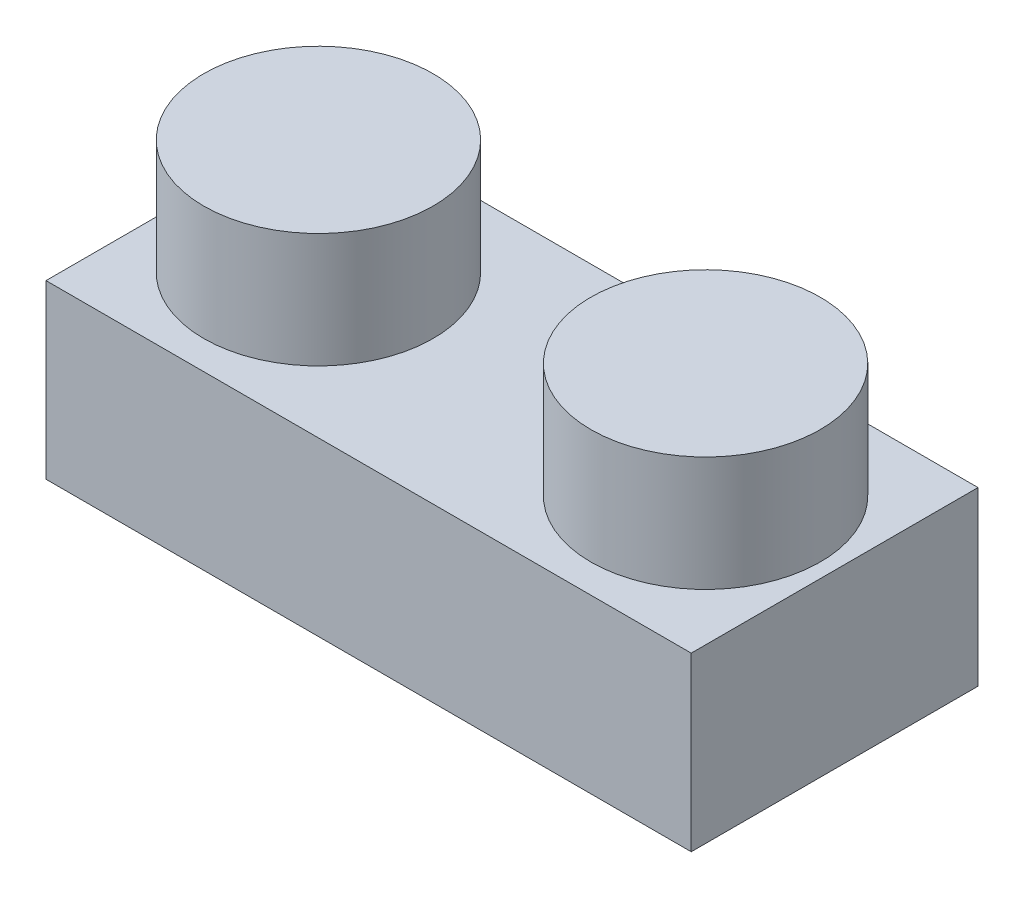
from build123d import *

# Parameters (mm, degrees)
SKETCH1_W           = 45
SKETCH1_H           = 20
BOSS_EXTRUDE1_DEPTH = 12
SKETCH2_R           = 8
BOSS_EXTRUDE2_DEPTH = 8


with BuildPart() as part:
    # Sketch1 → Boss-Extrude1 (new body)
    with BuildSketch(Plane(origin=(0, 0, 0), x_dir=(1, 0, 0), z_dir=(0, 1, 0))):
        Rectangle(SKETCH1_W, SKETCH1_H)
    extrude(amount=BOSS_EXTRUDE1_DEPTH)

    # Sketch2 → Boss-Extrude2 (add)
    with BuildSketch(Plane(origin=(0, 12, 0), x_dir=(1, 0, 0), z_dir=(0, 1, 0))):
        with Locations(Location((-13.5, 0, 0), (0, 0, 270))):
            Circle(SKETCH2_R)
        with Locations(Location((13.5, 0, 0), (0, 0, 270))):
            Circle(SKETCH2_R)
    extrude(amount=BOSS_EXTRUDE2_DEPTH)


solid = part.part
